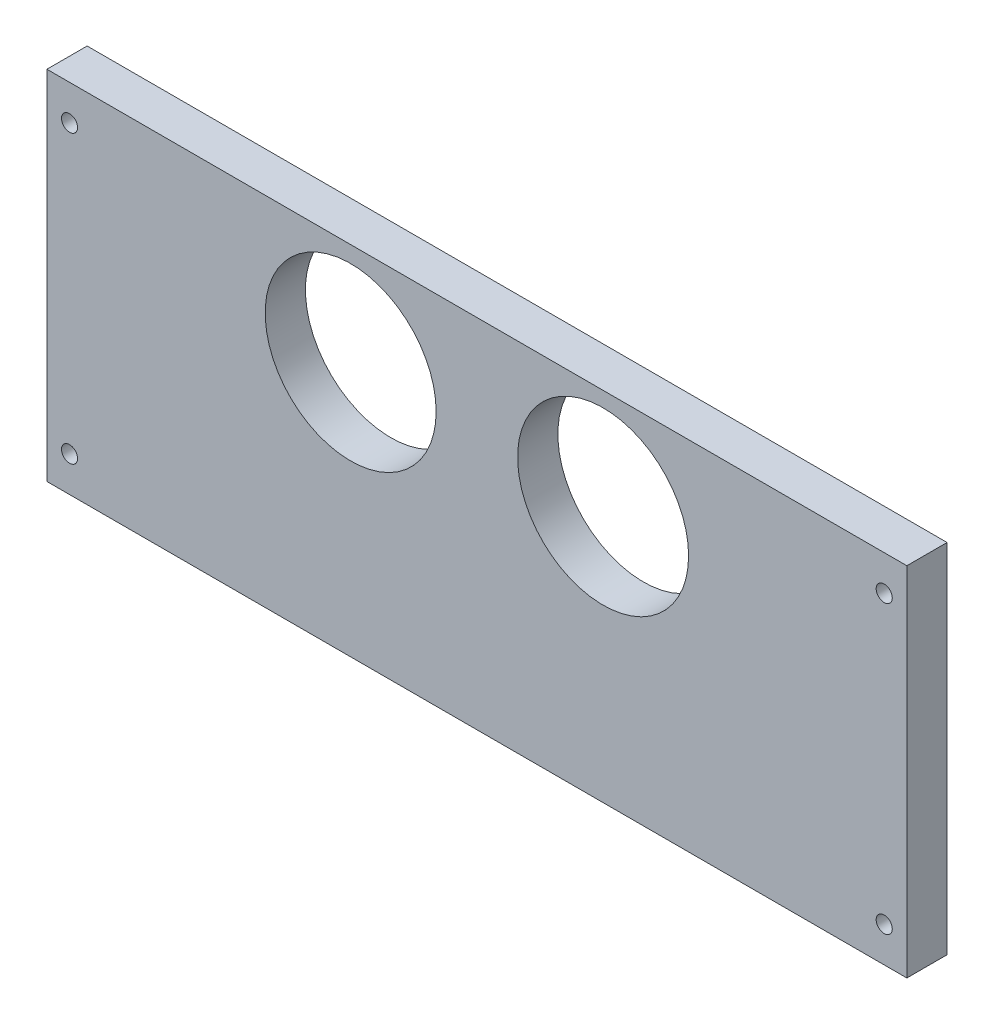
from build123d import *

# Parameters (mm, degrees)
SKETCH1_W             = 85.5
SKETCH1_H             = 35.5
BOSS_EXTRUDE1_DEPTH   = 4
M2_TAPPED_HOLE1_D     = 1.6
M2_TAPPED_HOLE1_DEPTH = 6
M2_TAPPED_HOLE1_TIP   = 0.480688495
SKETCH4_R             = 8.5
CUT_EXTRUDE1_DEPTH    = 10


with BuildPart() as part:
    # Sketch1 → Boss-Extrude1 (new body)
    with BuildSketch(Plane.XY):
        Rectangle(SKETCH1_W, SKETCH1_H)
    extrude(amount=-BOSS_EXTRUDE1_DEPTH)

    # M2 Tapped Hole1
    with Locations(Plane.XY):
        with Locations((40.5, 14.25), (-40.5, 14.25), (40.5, -14.25), (-40.5, -14.25)):
            Hole(M2_TAPPED_HOLE1_D / 2, depth=M2_TAPPED_HOLE1_DEPTH)
            with Locations((0, 0, -(M2_TAPPED_HOLE1_DEPTH + M2_TAPPED_HOLE1_TIP / 2))):  # 118° drill point
                Cone(0, M2_TAPPED_HOLE1_D / 2, M2_TAPPED_HOLE1_TIP, mode=Mode.SUBTRACT)

    # Sketch4 → Cut-Extrude1 (cut)
    with BuildSketch(Plane.XY):
        with Locations((12.55, 7.75)):
            Circle(SKETCH4_R)
        with Locations((-12.55, 7.61724702)):
            Circle(SKETCH4_R)
    extrude(amount=-CUT_EXTRUDE1_DEPTH, mode=Mode.SUBTRACT)


solid = part.part
